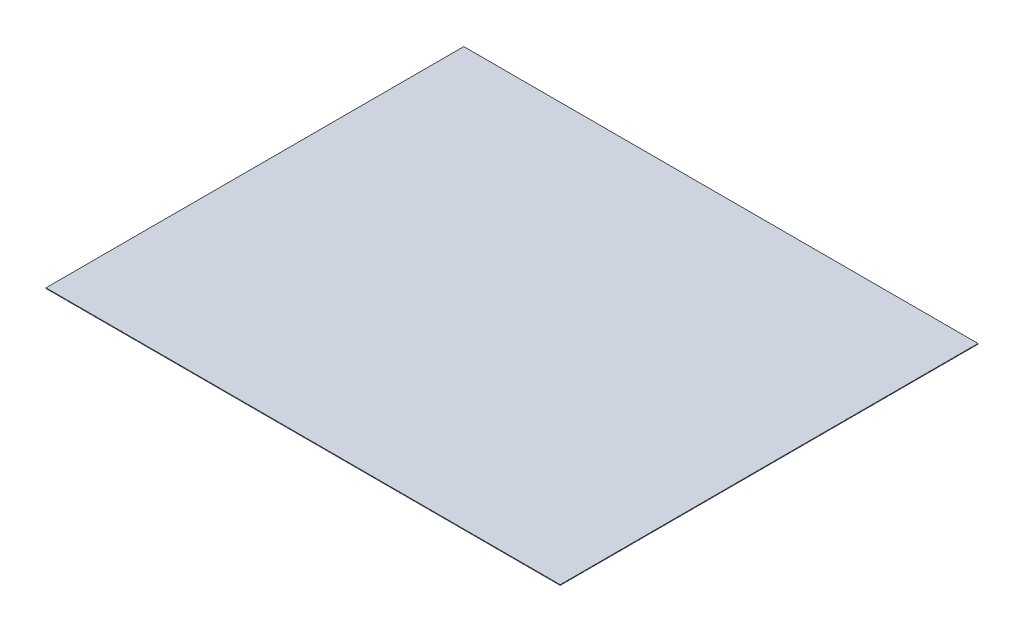
from build123d import *

# Parameters (mm, degrees)
SKETCH1_W           = 1600
SKETCH1_H           = 1300
BOSS_EXTRUDE1_DEPTH = 2


with BuildPart() as part:
    # Sketch1 → Boss-Extrude1 (new body)
    with BuildSketch(Plane(origin=(0, 0, 0), x_dir=(1, 0, 0), z_dir=(0, 1, 0))):
        Rectangle(SKETCH1_W, SKETCH1_H)
    extrude(amount=BOSS_EXTRUDE1_DEPTH)


solid = part.part
